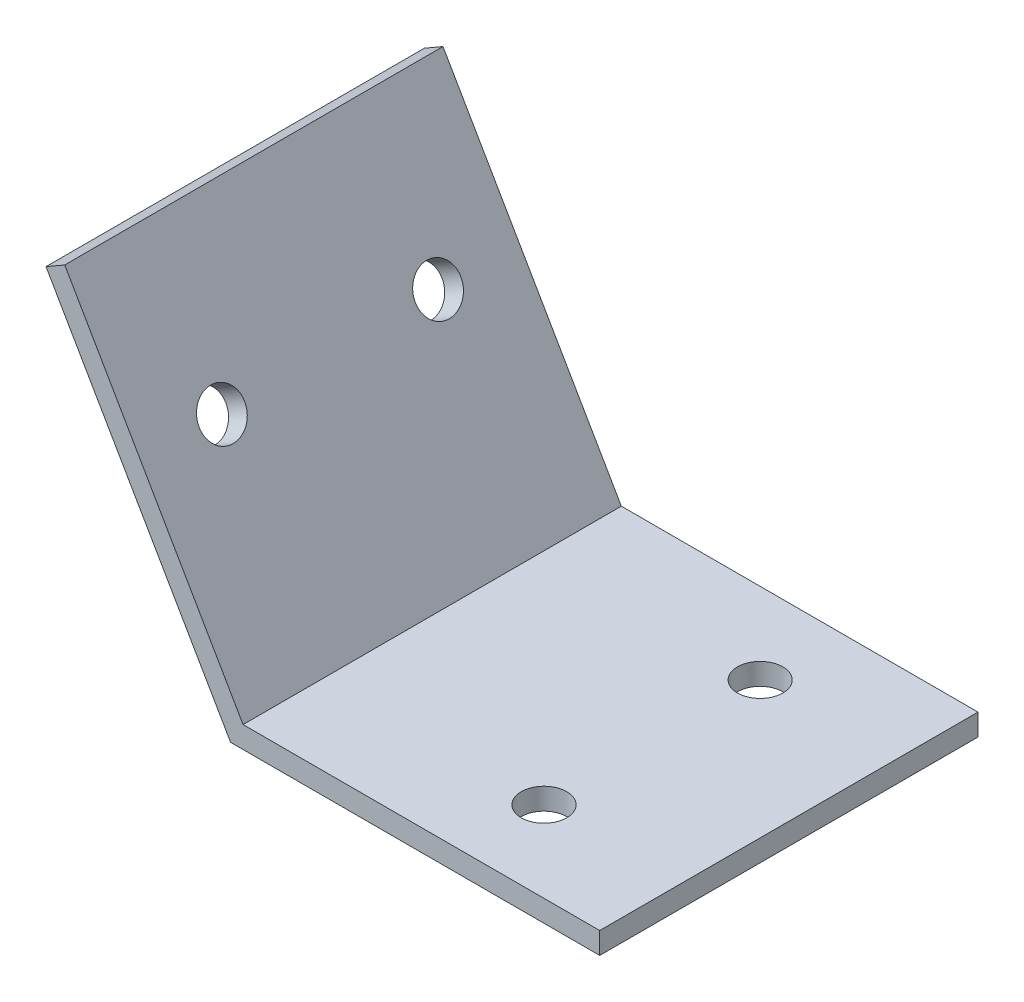
from build123d import *

# Parameters (mm, degrees)
EXTRUDE_3_DEPTH     = 35
SKETCH_3_R          = 2.1
CUT_EXTRUDE_1_DEPTH = 58.676762411
SKETCH_4_R          = 2.1
CUT_EXTRUDE_2_DEPTH = 58.676762411


with BuildPart() as part:
    # 草图1 → 凸台-拉伸3 (new body)
    with BuildSketch(Plane.XY):
        Polygon((0, 0), (34.154700538, 0), (34.154700538, 2), (1.154700538, 2), (-15.345299462, 30.578838325), (-17.077350269, 29.578838325), align=None)
    extrude(amount=EXTRUDE_3_DEPTH)

    # 草图3 → 切除-拉伸1 (cut, through all)
    with BuildSketch(Plane.XZ):
        with Locations((21.5, 27.5)):
            Circle(SKETCH_3_R)
        with Locations((21.5, 7.5)):
            Circle(SKETCH_3_R)
    extrude(amount=-CUT_EXTRUDE_1_DEPTH, mode=Mode.SUBTRACT)

    # 草图4 → 切除-拉伸2 (cut, through all)
    with BuildSketch(Plane(origin=(0, 0, 0), x_dir=(0, 0, 1), z_dir=(-0.8660254037844397, -0.499999999999998, 0))):
        with Locations(Location((27.5, 20.07, 0), (0, 0, 270))):
            Circle(SKETCH_4_R)
        with Locations(Location((7.5, 20.07, 0), (0, 0, 270))):
            Circle(SKETCH_4_R)
    extrude(amount=-CUT_EXTRUDE_2_DEPTH, mode=Mode.SUBTRACT)


solid = part.part
